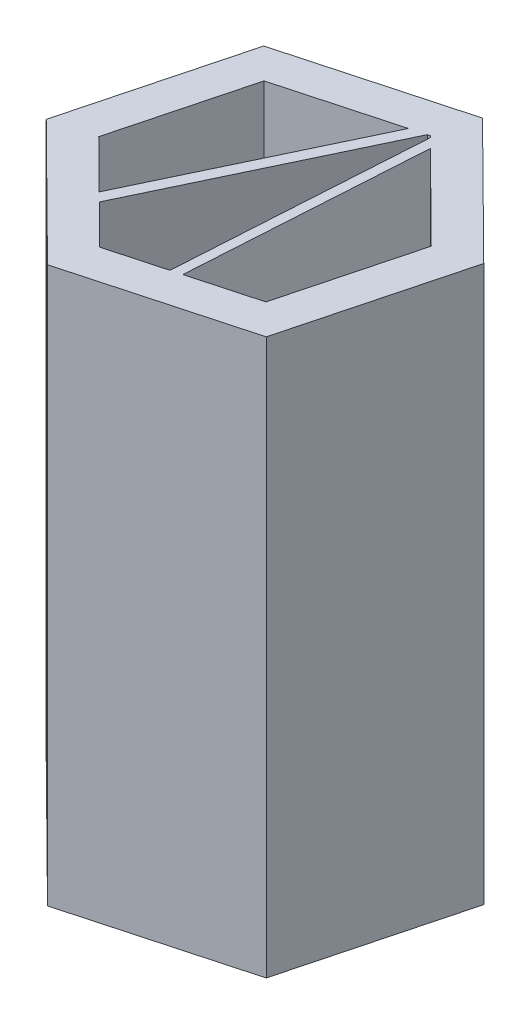
from build123d import *

# Parameters (mm, degrees)
BOSS_EXTRUDE1_DEPTH = 45
BOSS_EXTRUDE2_DEPTH = 45


with BuildPart() as part:
    # Sketch1 → Boss-Extrude1 (new body)
    with BuildSketch(Plane(origin=(0, 0, 0), x_dir=(1, 0, 0), z_dir=(0, 1, 0))):
        Polygon((10.257365227, -10.154791575), (13.922990088, 3.805743075), (3.66562486, 13.96053465), (-10.257365227, 10.154791575), (-13.922990088, -3.805743075), (-3.66562486, -13.96053465), align=None)
        Polygon((-2.785874894, -10.610006334), (7.795597573, -7.717641597), (10.581472467, 2.892364737), (2.785874894, 10.610006334), (-7.795597573, 7.717641597), (-10.581472467, -2.892364737), align=None, mode=Mode.SUBTRACT)
    extrude(amount=BOSS_EXTRUDE1_DEPTH)

    # Sketch2 → Boss-Extrude2 (add)
    with BuildSketch(Plane(origin=(0, 45, 0), x_dir=(1, 0, 0), z_dir=(0, 1, 0))):
        Polygon((-6.68367368, -6.751185536), (1.391190433, 10.228779981), (2.592952284, 10.557272411), (-5.972802955, -7.454947554), align=None)
        Polygon((2.504861339, -9.163823965), (3.684441387, 9.720425506), (2.928005116, 10.469297414), (1.68769549, -9.387190014), align=None)
    extrude(amount=-BOSS_EXTRUDE2_DEPTH)


solid = part.part
